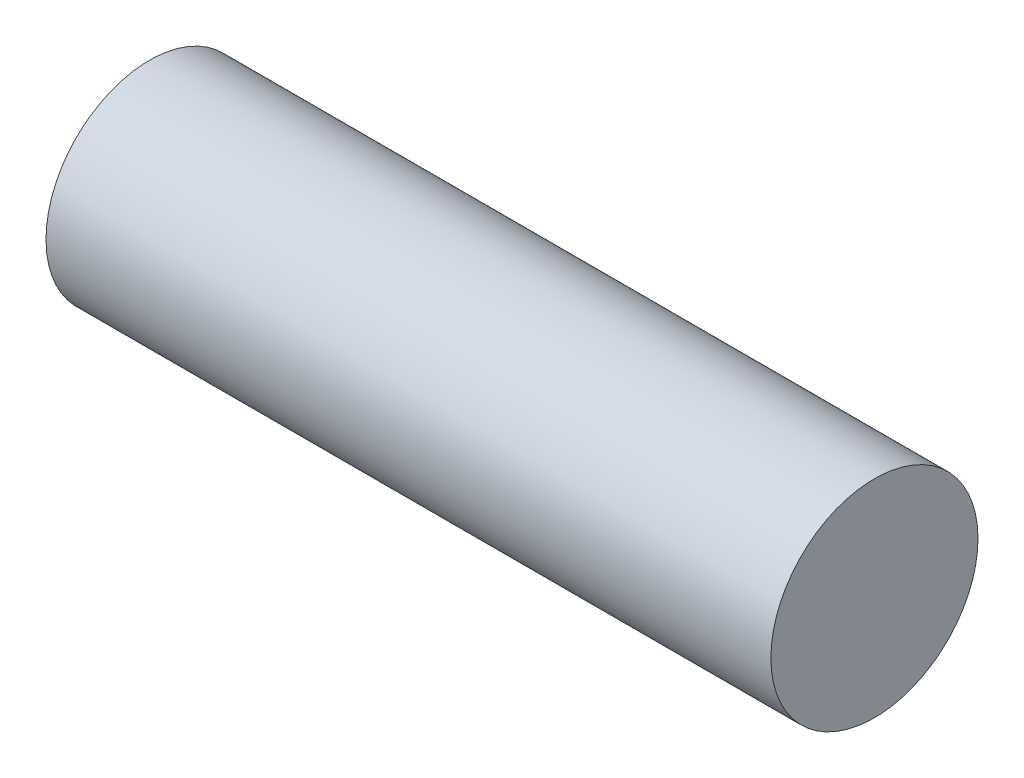
from build123d import *

# Parameters (mm, degrees)
SKETCH1_R           = 1
BOSS_EXTRUDE1_DEPTH = 7


with BuildPart() as part:
    # Sketch1 → Boss-Extrude1 (new body)
    with BuildSketch(Plane(origin=(0, 0, 0), x_dir=(0, 0, -1), z_dir=(1, 0, 0))):
        Circle(SKETCH1_R)
    extrude(amount=BOSS_EXTRUDE1_DEPTH)


solid = part.part
